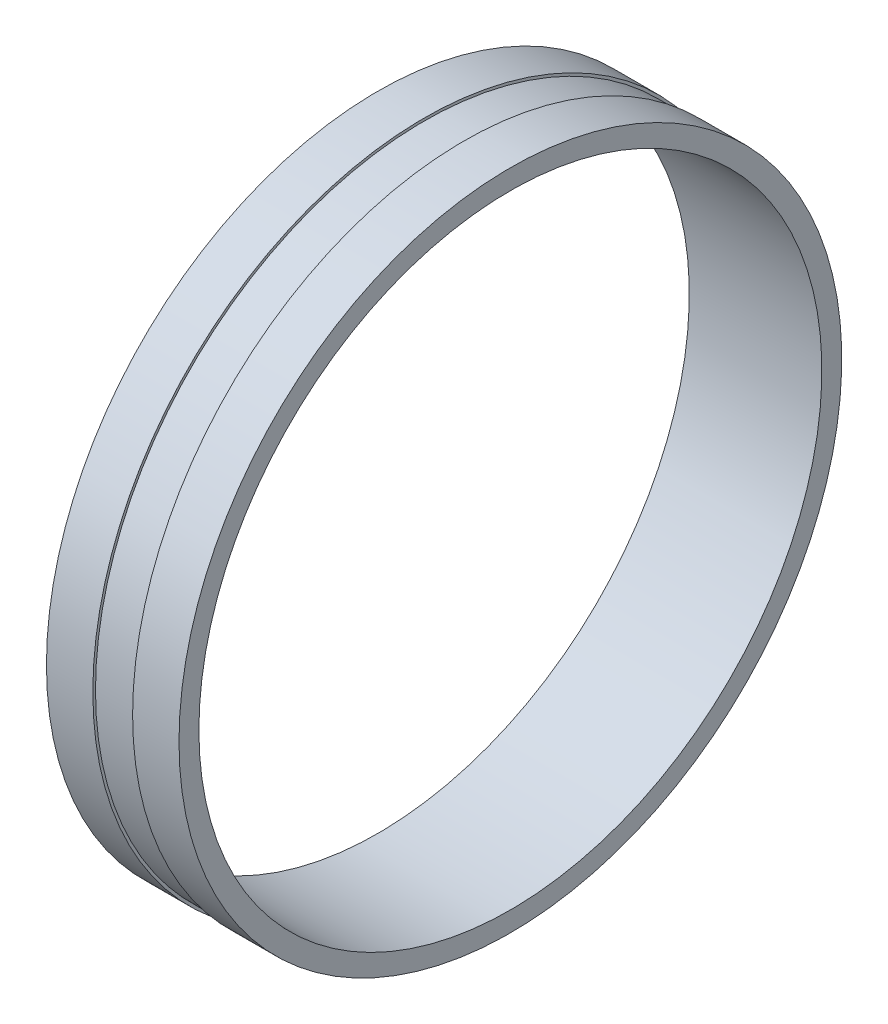
from build123d import *


with BuildPart() as part:
    # Szkic2 → Obrót1 (revolve)
    with BuildSketch(Plane.XY, mode=Mode.PRIVATE) as obr_t1_sk:
        Polygon((-425.537809827, -177.948573753), (-422.037809827, -177.948573753), (-422.037809827, -178.148573753), (-419.037809827, -178.148573753), (-419.037809827, -177.948573753), (-415.537809827, -177.948573753), (-415.537809827, -179.448573753), (-425.537809827, -179.448573753), align=None)
    revolve(obr_t1_sk.sketch.rotate(Axis((-411.49910078, -202.948573753, 0), (1, 0, 0)), 90), axis=Axis((-411.49910078, -202.948573753, 0), (1, 0, 0)))


solid = part.part
